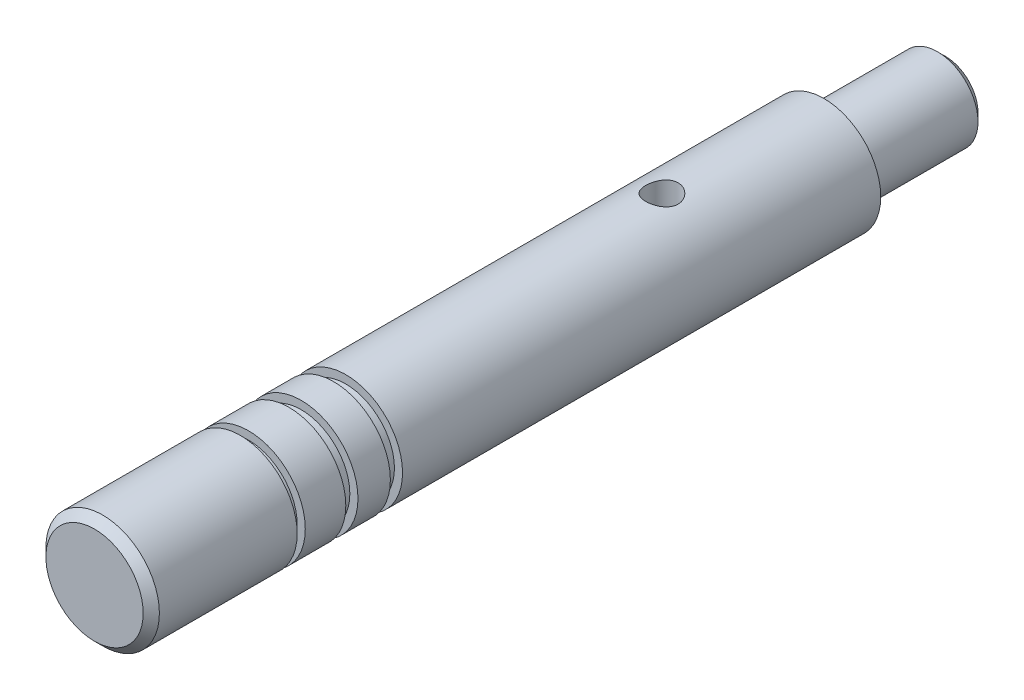
from build123d import *

# Parameters (mm, degrees)
ESQUISSE1_R                  = 2.5
BOSS_EXTRU_1_DEPTH           = 7.5
ESQUISSE2_R                  = 3.5
BOSS_EXTRU_2_DEPTH           = 29.5
ESQUISSE3_R                  = 3
BOSS_EXTRU_3_DEPTH           = 0.75
ESQUISSE4_R                  = 3.5
BOSS_EXTRU_4_DEPTH           = 2
ESQUISSE5_R                  = 3
BOSS_EXTRU_5_DEPTH           = 0.75
ESQUISSE6_R                  = 3.5
BOSS_EXTRU_6_DEPTH           = 2.5
ESQUISSE7_R                  = 3
BOSS_EXTRU_7_DEPTH           = 0.5
ESQUISSE8_R                  = 3.5
BOSS_EXTRU_8_DEPTH           = 9
CHANFREIN2_SIZE              = 0.5
ENL_V_MAT_EXTRU_1_DEPTH      = 53.732817107
ENL_V_MAT_EXTRU_1_DEPTH_BACK = 53.732817107
ESQUISSE9_R                  = 1


with BuildPart() as part:
    # Esquisse1 → Boss.-Extru.1 (new body)
    with BuildSketch(Plane.XY):
        Circle(ESQUISSE1_R)
    extrude(amount=BOSS_EXTRU_1_DEPTH)

    # Esquisse2 → Boss.-Extru.2 (add)
    with BuildSketch(Plane.XY.offset(7.5)):
        Circle(ESQUISSE2_R)
    extrude(amount=BOSS_EXTRU_2_DEPTH)

    # Esquisse3 → Boss.-Extru.3 (add)
    with BuildSketch(Plane.XY.offset(37)):
        Circle(ESQUISSE3_R)
    extrude(amount=BOSS_EXTRU_3_DEPTH)

    # Esquisse4 → Boss.-Extru.4 (add)
    with BuildSketch(Plane.XY.offset(37.75)):
        Circle(ESQUISSE4_R)
    extrude(amount=BOSS_EXTRU_4_DEPTH)

    # Esquisse5 → Boss.-Extru.5 (add)
    with BuildSketch(Plane.XY.offset(39.75)):
        Circle(ESQUISSE5_R)
    extrude(amount=BOSS_EXTRU_5_DEPTH)

    # Esquisse6 → Boss.-Extru.6 (add)
    with BuildSketch(Plane.XY.offset(40.5)):
        Circle(ESQUISSE6_R)
    extrude(amount=BOSS_EXTRU_6_DEPTH)

    # Esquisse7 → Boss.-Extru.7 (add)
    with BuildSketch(Plane.XY.offset(43)):
        Circle(ESQUISSE7_R)
    extrude(amount=BOSS_EXTRU_7_DEPTH)

    # Esquisse8 → Boss.-Extru.8 (add)
    with BuildSketch(Plane.XY.offset(43.5)):
        Circle(ESQUISSE8_R)
    extrude(amount=BOSS_EXTRU_8_DEPTH)

    # Chanfrein2
    chanfrein2_edges = [part.edges().sort_by_distance(p)[0] for p in [
        (-2.5, 0, 0),
        (-3.5, 0, 52.5),
    ]]
    chamfer(chanfrein2_edges, length=CHANFREIN2_SIZE)

    # Esquisse9 → Enlèv. mat.-Extru.1 (cut, two sides: drawn at the far end of the back side and taken through both)
    with BuildSketch(Plane(origin=(0, 0, 0), x_dir=(1, 0, 0), z_dir=(0, 1, 0)).offset(-ENL_V_MAT_EXTRU_1_DEPTH_BACK)):
        with Locations(Location((0, -17.5, 0), (0, 0, 270))):
            Circle(ESQUISSE9_R)
    extrude(amount=ENL_V_MAT_EXTRU_1_DEPTH + ENL_V_MAT_EXTRU_1_DEPTH_BACK, mode=Mode.SUBTRACT)


solid = part.part
